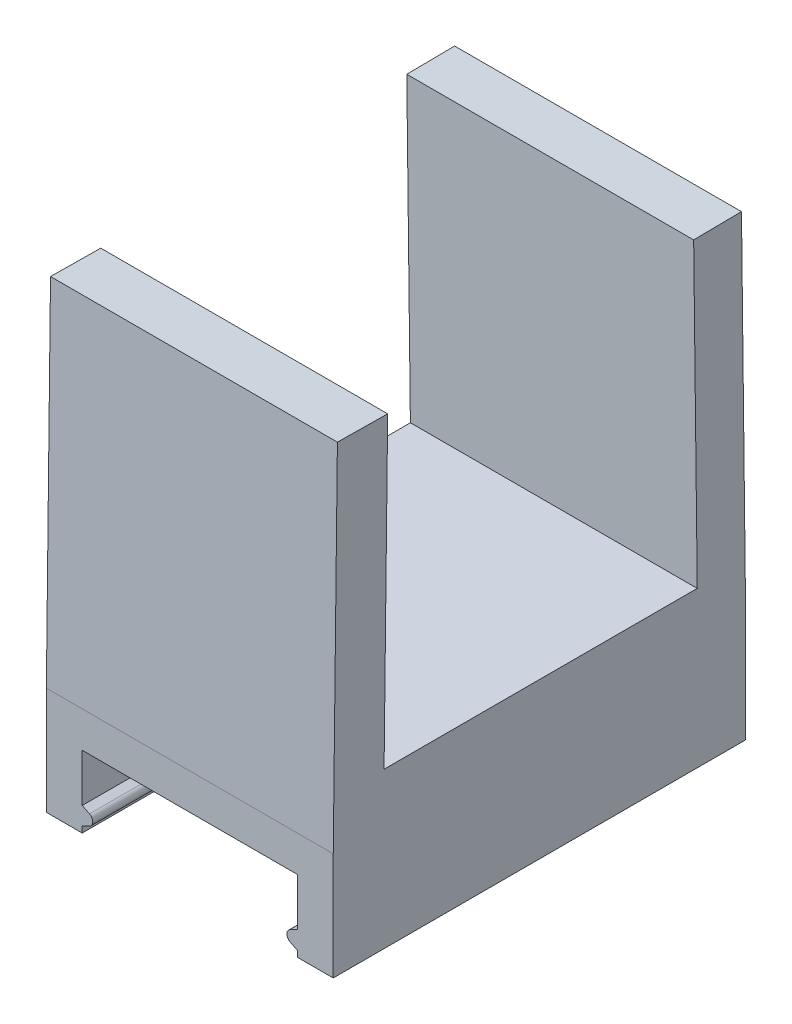
from build123d import *

# Parameters (mm, degrees)
BOSS_EXTRUDE1_DEPTH = 34.5
BOSS_EXTRUDE2_DEPTH = 24


with BuildPart() as part:
    # Sketch2 → Boss-Extrude1 (new body)
    with BuildSketch(Plane.XY):
        with BuildLine():
            Line((-9, 3), (9, 3))
            Line((9, 3), (9, -1))
            Line((9, -1), (8.394427191, -1.302786405))
            ThreePointArc((8.394427191, -1.302786405), (8.118033989, -1.75), (8.394427191, -2.197213595))
            Line((8.394427191, -2.197213595), (9, -2.5))
            Line((9, -2.5), (9, -3))
            Line((9, -3), (12, -3))
            Line((12, -3), (12, 6))
            Line((12, 6), (-12, 6))
            Line((-12, 6), (-12, -3))
            Line((-12, -3), (-9, -3))
            Line((-9, -3), (-9, -2.5))
            Line((-9, -2.5), (-8.394427191, -2.197213595))
            ThreePointArc((-8.394427191, -2.197213595), (-8.118033989, -1.75), (-8.394427191, -1.302786405))
            Line((-8.394427191, -1.302786405), (-9, -1))
            Line((-9, -1), (-9, 3))
        make_face()
    extrude(amount=BOSS_EXTRUDE1_DEPTH)

    # Sketch3 → Boss-Extrude2 (add)
    with BuildSketch(Plane.ZY.offset(12)):
        Polygon((29.947523085, 35.6), (30.247523085, 10), (4.047523085, 10), (4.347523085, 35.4), (0.347802057, 35.4472408), (0, 6), (34.5, 6), (34.152547528, 35.64927763), align=None)
    extrude(amount=-BOSS_EXTRUDE2_DEPTH)


solid = part.part
